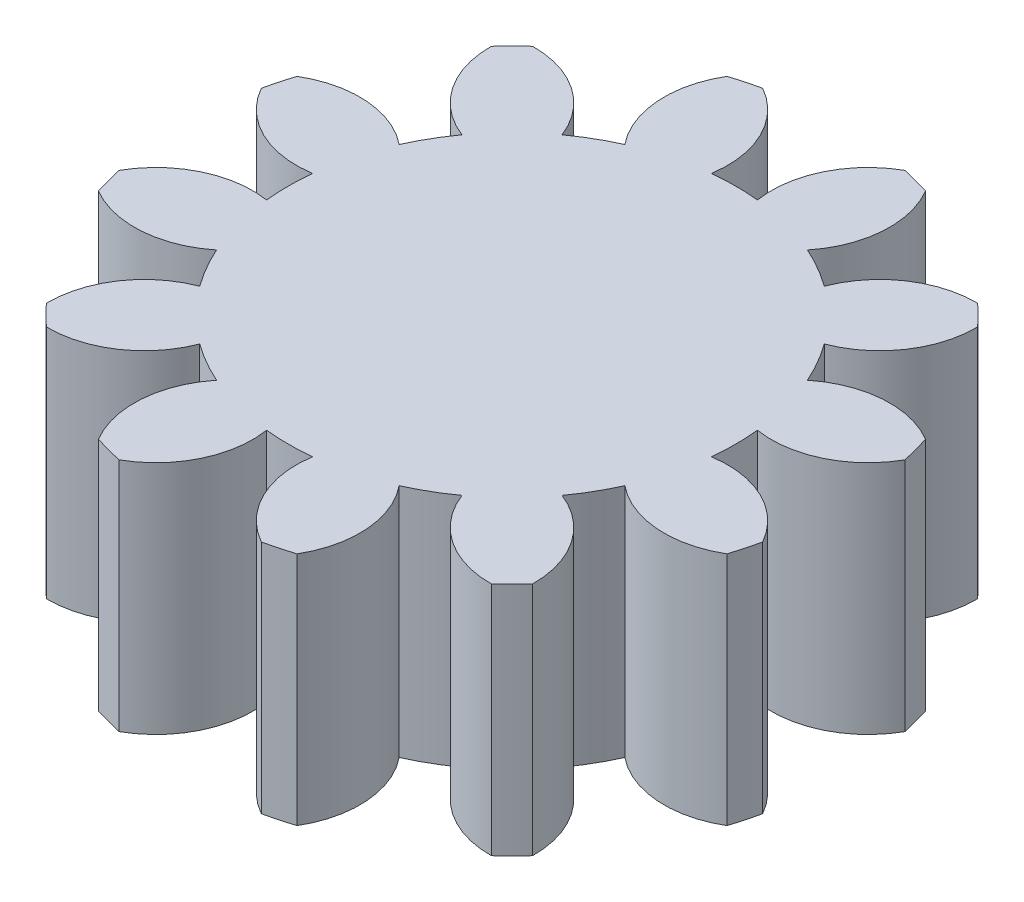
from build123d import *

# Parameters (mm, degrees)
SKETCH1_R                 = 4.2
BOSS_EXTRUDE1_DEPTH       = 3
CUT_EXTRUDE2_DEPTH        = 3
CIRPATTERN1_COUNT         = 12
CIRPATTERN1_COPY_1_DEPTH  = 3
CIRPATTERN1_COPY_2_DEPTH  = 3
CIRPATTERN1_COPY_3_DEPTH  = 3
CIRPATTERN1_COPY_4_DEPTH  = 3
CIRPATTERN1_COPY_5_DEPTH  = 3
CIRPATTERN1_COPY_6_DEPTH  = 3
CIRPATTERN1_COPY_7_DEPTH  = 3
CIRPATTERN1_COPY_8_DEPTH  = 3
CIRPATTERN1_COPY_9_DEPTH  = 3
CIRPATTERN1_COPY_10_DEPTH = 3
CIRPATTERN1_COPY_11_DEPTH = 3


with BuildPart() as part:
    # Sketch1 → Boss-Extrude1 (new body)
    with BuildSketch(Plane(origin=(0, 0, 0), x_dir=(1, 0, 0), z_dir=(0, 1, 0))):
        with Locations(Location((0, 0, 0), (0, 0, 270))):
            Circle(SKETCH1_R)
    extrude(amount=BOSS_EXTRUDE1_DEPTH)

    # Sketch2 → Cut-Extrude2 (cut)
    with BuildSketch(Plane(origin=(0, 3, 0), x_dir=(1, 0, 0), z_dir=(0, 1, 0))):
        with BuildLine():
            Line((-1.108658308, 4.191722636), (0, 5.977827248))
            Line((0, 5.977827248), (0, 2.85))
            ThreePointArc((0, 2.85), (-0.146635628, 2.846225218), (-0.292882823, 2.834910872))
            ThreePointArc((-0.292882823, 2.834910872), (-0.454077223, 3.661639746), (-1.108658308, 4.191722636))
        make_face()
    cut_extrude2 = extrude(amount=-CUT_EXTRUDE2_DEPTH, mode=Mode.SUBTRACT)

    # Mirror2: Cut-Extrude2 across plane
    add(cut_extrude2.mirror(Plane.ZY), mode=Mode.SUBTRACT)

    # CirPattern1: Cut-Extrude2 ×12 about axis
    cirpattern1_axis = Axis((0, 0, 0), (0, 1, 0))
    for i in range(1, CIRPATTERN1_COUNT):
        add(cut_extrude2.rotate(cirpattern1_axis, i * 360 / CIRPATTERN1_COUNT), mode=Mode.SUBTRACT)

    # CirPattern1 copy 1 sketch → CirPattern1 copy 1 (cut)
    with BuildSketch(Plane(origin=(0, 3, 0), x_dir=(-0.8660254037844387, 0, 0.49999999999999994), z_dir=(0, 1, 0))):
        with BuildLine():
            Line((-1.108658308, -4.191722636), (0, -5.977827248))
            Line((0, -5.977827248), (0, -2.85))
            ThreePointArc((0, -2.85), (-0.146635628, -2.846225218), (-0.292882823, -2.834910872))
            ThreePointArc((-0.292882823, -2.834910872), (-0.454077223, -3.661639746), (-1.108658308, -4.191722636))
        make_face()
    extrude(amount=-CIRPATTERN1_COPY_1_DEPTH, mode=Mode.SUBTRACT)

    # CirPattern1 copy 2 sketch → CirPattern1 copy 2 (cut)
    with BuildSketch(Plane(origin=(0, 3, 0), x_dir=(-0.5000000000000001, 0, 0.8660254037844386), z_dir=(0, 1, 0))):
        with BuildLine():
            Line((-1.108658308, -4.191722636), (0, -5.977827248))
            Line((0, -5.977827248), (0, -2.85))
            ThreePointArc((0, -2.85), (-0.146635628, -2.846225218), (-0.292882823, -2.834910872))
            ThreePointArc((-0.292882823, -2.834910872), (-0.454077223, -3.661639746), (-1.108658308, -4.191722636))
        make_face()
    extrude(amount=-CIRPATTERN1_COPY_2_DEPTH, mode=Mode.SUBTRACT)

    # CirPattern1 copy 3 sketch → CirPattern1 copy 3 (cut)
    with BuildSketch(Plane.ZX.offset(3)):
        with BuildLine():
            Line((-1.108658308, -4.191722636), (0, -5.977827248))
            Line((0, -5.977827248), (0, -2.85))
            ThreePointArc((0, -2.85), (-0.146635628, -2.846225218), (-0.292882823, -2.834910872))
            ThreePointArc((-0.292882823, -2.834910872), (-0.454077223, -3.661639746), (-1.108658308, -4.191722636))
        make_face()
    extrude(amount=-CIRPATTERN1_COPY_3_DEPTH, mode=Mode.SUBTRACT)

    # CirPattern1 copy 4 sketch → CirPattern1 copy 4 (cut)
    with BuildSketch(Plane(origin=(0, 3, 0), x_dir=(0.4999999999999998, 0, 0.8660254037844387), z_dir=(0, 1, 0))):
        with BuildLine():
            Line((-1.108658308, -4.191722636), (0, -5.977827248))
            Line((0, -5.977827248), (0, -2.85))
            ThreePointArc((0, -2.85), (-0.146635628, -2.846225218), (-0.292882823, -2.834910872))
            ThreePointArc((-0.292882823, -2.834910872), (-0.454077223, -3.661639746), (-1.108658308, -4.191722636))
        make_face()
    extrude(amount=-CIRPATTERN1_COPY_4_DEPTH, mode=Mode.SUBTRACT)

    # CirPattern1 copy 5 sketch → CirPattern1 copy 5 (cut)
    with BuildSketch(Plane(origin=(0, 3, 0), x_dir=(0.8660254037844387, 0, 0.49999999999999994), z_dir=(0, 1, 0))):
        with BuildLine():
            Line((-1.108658308, -4.191722636), (0, -5.977827248))
            Line((0, -5.977827248), (0, -2.85))
            ThreePointArc((0, -2.85), (-0.146635628, -2.846225218), (-0.292882823, -2.834910872))
            ThreePointArc((-0.292882823, -2.834910872), (-0.454077223, -3.661639746), (-1.108658308, -4.191722636))
        make_face()
    extrude(amount=-CIRPATTERN1_COPY_5_DEPTH, mode=Mode.SUBTRACT)

    # CirPattern1 copy 6 sketch → CirPattern1 copy 6 (cut)
    with BuildSketch(Plane(origin=(0, 3, 0), x_dir=(1, 0, 0), z_dir=(0, 1, 0))):
        with BuildLine():
            Line((-1.108658308, -4.191722636), (0, -5.977827248))
            Line((0, -5.977827248), (0, -2.85))
            ThreePointArc((0, -2.85), (-0.146635628, -2.846225218), (-0.292882823, -2.834910872))
            ThreePointArc((-0.292882823, -2.834910872), (-0.454077223, -3.661639746), (-1.108658308, -4.191722636))
        make_face()
    extrude(amount=-CIRPATTERN1_COPY_6_DEPTH, mode=Mode.SUBTRACT)

    # CirPattern1 copy 7 sketch → CirPattern1 copy 7 (cut)
    with BuildSketch(Plane(origin=(0, 3, 0), x_dir=(0.8660254037844386, 0, -0.5000000000000001), z_dir=(0, 1, 0))):
        with BuildLine():
            Line((-1.108658308, -4.191722636), (0, -5.977827248))
            Line((0, -5.977827248), (0, -2.85))
            ThreePointArc((0, -2.85), (-0.146635628, -2.846225218), (-0.292882823, -2.834910872))
            ThreePointArc((-0.292882823, -2.834910872), (-0.454077223, -3.661639746), (-1.108658308, -4.191722636))
        make_face()
    extrude(amount=-CIRPATTERN1_COPY_7_DEPTH, mode=Mode.SUBTRACT)

    # CirPattern1 copy 8 sketch → CirPattern1 copy 8 (cut)
    with BuildSketch(Plane(origin=(0, 3, 0), x_dir=(0.5000000000000004, 0, -0.8660254037844384), z_dir=(0, 1, 0))):
        with BuildLine():
            Line((-1.108658308, -4.191722636), (0, -5.977827248))
            Line((0, -5.977827248), (0, -2.85))
            ThreePointArc((0, -2.85), (-0.146635628, -2.846225218), (-0.292882823, -2.834910872))
            ThreePointArc((-0.292882823, -2.834910872), (-0.454077223, -3.661639746), (-1.108658308, -4.191722636))
        make_face()
    extrude(amount=-CIRPATTERN1_COPY_8_DEPTH, mode=Mode.SUBTRACT)

    # CirPattern1 copy 9 sketch → CirPattern1 copy 9 (cut)
    with BuildSketch(Plane(origin=(0, 3, 0), x_dir=(0, 0, -1), z_dir=(0, 1, 0))):
        with BuildLine():
            Line((-1.108658308, -4.191722636), (0, -5.977827248))
            Line((0, -5.977827248), (0, -2.85))
            ThreePointArc((0, -2.85), (-0.146635628, -2.846225218), (-0.292882823, -2.834910872))
            ThreePointArc((-0.292882823, -2.834910872), (-0.454077223, -3.661639746), (-1.108658308, -4.191722636))
        make_face()
    extrude(amount=-CIRPATTERN1_COPY_9_DEPTH, mode=Mode.SUBTRACT)

    # CirPattern1 copy 10 sketch → CirPattern1 copy 10 (cut)
    with BuildSketch(Plane(origin=(0, 3, 0), x_dir=(-0.5000000000000001, 0, -0.8660254037844386), z_dir=(0, 1, 0))):
        with BuildLine():
            Line((-1.108658308, -4.191722636), (0, -5.977827248))
            Line((0, -5.977827248), (0, -2.85))
            ThreePointArc((0, -2.85), (-0.146635628, -2.846225218), (-0.292882823, -2.834910872))
            ThreePointArc((-0.292882823, -2.834910872), (-0.454077223, -3.661639746), (-1.108658308, -4.191722636))
        make_face()
    extrude(amount=-CIRPATTERN1_COPY_10_DEPTH, mode=Mode.SUBTRACT)

    # CirPattern1 copy 11 sketch → CirPattern1 copy 11 (cut)
    with BuildSketch(Plane(origin=(0, 3, 0), x_dir=(-0.8660254037844384, 0, -0.5000000000000004), z_dir=(0, 1, 0))):
        with BuildLine():
            Line((-1.108658308, -4.191722636), (0, -5.977827248))
            Line((0, -5.977827248), (0, -2.85))
            ThreePointArc((0, -2.85), (-0.146635628, -2.846225218), (-0.292882823, -2.834910872))
            ThreePointArc((-0.292882823, -2.834910872), (-0.454077223, -3.661639746), (-1.108658308, -4.191722636))
        make_face()
    extrude(amount=-CIRPATTERN1_COPY_11_DEPTH, mode=Mode.SUBTRACT)


solid = part.part
